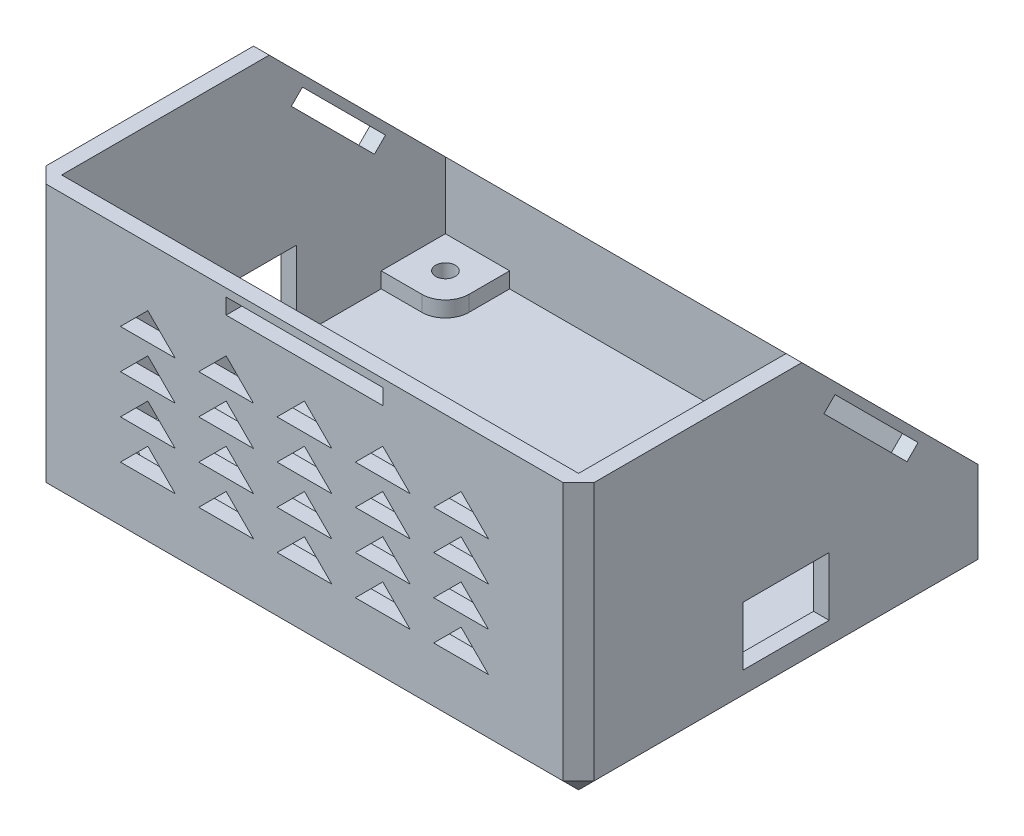
from build123d import *

# Parameters (mm, degrees)
SKETCH1_W               = 70
SKETCH1_H               = 53
SKETCH1_W_2             = 66
SKETCH1_H_2             = 49
BOSS_EXTRUDE1_DEPTH     = 2
BOSS_EXTRUDE2_START     = 2
SKETCH1_3_W             = 70
SKETCH1_3_H             = 53
SKETCH1_3_W_2           = 66
SKETCH1_3_H_2           = 49
BOSS_EXTRUDE2_DEPTH     = 33
CHAMFER1_SIZE           = 2
SKETCH2_R               = 1.25
BOSS_EXTRUDE3_DEPTH     = 2
MIRROR2_COPY_1_SKETCH_R = 1.25
MIRROR2_COPY_1_DEPTH    = 2
CUT_EXTRUDE1_DEPTH      = 1.6
MIRROR4_COPY_1_DEPTH    = 1.6
CUT_EXTRUDE2_DEPTH      = 55.92039694
CUT_EXTRUDE2_DEPTH_BACK = 55.92039694
SKETCH4_R               = 1.25
SKETCH7_W               = 11
SKETCH7_H               = 7.5
CUT_EXTRUDE5_DEPTH      = 83.627174707
CUT_EXTRUDE3_DEPTH      = 72.070387645
CUT_EXTRUDE3_DEPTH_BACK = 72.070387645
SKETCH5_W               = 20
SKETCH5_H               = 2
CUT_EXTRUDE8_DEPTH      = 83.627174707
CUT_EXTRUDE4_DEPTH      = 81.939792439
CUT_EXTRUDE4_DEPTH_BACK = 81.939792439
CUT_EXTRUDE9_REACH      = 74.519
LPATTERN2_COUNT         = 3
LPATTERN2_PITCH         = 10
LPATTERN2_COL_COUNT     = 3
LPATTERN2_COL_PITCH     = 10
LPATTERN3_COUNT         = 4
LPATTERN3_PITCH         = 5
LPATTERN3_COPY_1_REACH  = 74.519
LPATTERN3_COPY_2_REACH  = 74.519
LPATTERN3_COPY_3_REACH  = 74.519
LPATTERN3_COPY_4_REACH  = 74.519
LPATTERN3_COPY_5_REACH  = 74.519
LPATTERN3_COPY_6_REACH  = 74.519
LPATTERN3_COPY_7_REACH  = 74.519
LPATTERN3_COPY_8_REACH  = 74.519
LPATTERN3_COPY_9_REACH  = 74.519
LPATTERN3_COPY_10_REACH = 74.519
LPATTERN3_COPY_11_REACH = 74.519
LPATTERN3_COPY_12_REACH = 74.519


with BuildPart() as part:
    # Sketch1 → Boss-Extrude1 (new body)
    # profile 1 of 2: a face of its own
    with BuildSketch(Plane(origin=(0, 0, 0), x_dir=(1, 0, 0), z_dir=(0, 1, 0))):
        Rectangle(SKETCH1_W, SKETCH1_H)
        Rectangle(SKETCH1_W_2, SKETCH1_H_2, mode=Mode.SUBTRACT)
    # profile 2 of 2: a face of its own
    with BuildSketch(Plane(origin=(0, 0, 0), x_dir=(1, 0, 0), z_dir=(0, 1, 0))):
        Rectangle(SKETCH1_W_2, SKETCH1_H_2)
    extrude(amount=BOSS_EXTRUDE1_DEPTH)

    # Sketch1<3> → Boss-Extrude2 (add)
    with BuildSketch(Plane(origin=(0, 0, 0), x_dir=(1, 0, 0), z_dir=(0, 1, 0)).offset(BOSS_EXTRUDE2_START)):
        Rectangle(SKETCH1_3_W, SKETCH1_3_H)
        Rectangle(SKETCH1_3_W_2, SKETCH1_3_H_2, mode=Mode.SUBTRACT)
    extrude(amount=BOSS_EXTRUDE2_DEPTH)

    # Chamfer1
    chamfer1_edges = [part.edges().sort_by_distance(p)[0] for p in [
        (0, 0, -26.5),
        (35, 0, 0),
        (0, 0, 26.5),
        (-35, 0, 0),
        (-35, 17.5, -26.5),
        (35, 17.5, -26.5),
        (35, 17.5, 26.5),
        (-35, 17.5, 26.5),
    ]]
    chamfer(chamfer1_edges, length=CHAMFER1_SIZE)

    # Sketch2 → Boss-Extrude3 (add)
    with BuildSketch(Plane(origin=(0, 2, 0), x_dir=(1, 0, 0), z_dir=(0, 1, 0))):
        with BuildLine():
            Line((-33, 16.3), (-27.8, 16.3))
            ThreePointArc((-27.8, 16.3), (-25.678679656, 17.178679656), (-24.8, 19.3))
            Line((-24.8, 19.3), (-24.8, 24.5))
            Line((-24.8, 24.5), (-33, 24.5))
            Line((-33, 24.5), (-33, 16.3))
        make_face()
        with Locations(Location((-28.9, 20.4, 0), (0, 0, 270))):
            Circle(SKETCH2_R, mode=Mode.SUBTRACT)
    boss_extrude3 = extrude(amount=BOSS_EXTRUDE3_DEPTH)

    # Mirror1: Boss-Extrude3 across plane
    add(boss_extrude3.mirror(Plane.XY))

    # Mirror2: Boss-Extrude3 across plane
    add(boss_extrude3.mirror(Plane(origin=(0, 0, 0), x_dir=(0, 0, 1), z_dir=(1, 0, 0))))

    # Mirror2 copy 1 sketch → Mirror2 copy 1 (add)
    with BuildSketch(Plane(origin=(0, 2, 0), x_dir=(-1, 0, 0), z_dir=(0, 1, 0))):
        with BuildLine():
            Line((-33, 16.3), (-27.8, 16.3))
            ThreePointArc((-27.8, 16.3), (-25.678679656, 17.178679656), (-24.8, 19.3))
            Line((-24.8, 19.3), (-24.8, 24.5))
            Line((-24.8, 24.5), (-33, 24.5))
            Line((-33, 24.5), (-33, 16.3))
        make_face()
        with Locations(Location((-28.9, 20.4, 0), (0, 0, 270))):
            Circle(MIRROR2_COPY_1_SKETCH_R, mode=Mode.SUBTRACT)
    extrude(amount=MIRROR2_COPY_1_DEPTH)

    # Sketch3 → Cut-Extrude1 (cut)
    with BuildSketch(Plane.XZ):
        Polygon((-30.112435565, 22.5), (-27.687564435, 22.5), (-26.475128869, 20.4), (-27.687564435, 18.3), (-30.112435565, 18.3), (-31.324871131, 20.4), align=None)
    cut_extrude1 = extrude(amount=-CUT_EXTRUDE1_DEPTH, mode=Mode.SUBTRACT)

    # Mirror3: Cut-Extrude1 across plane
    add(cut_extrude1.mirror(Plane.XY), mode=Mode.SUBTRACT)

    # Mirror4: Cut-Extrude1 across plane
    add(cut_extrude1.mirror(Plane(origin=(0, 0, 0), x_dir=(0, 0, 1), z_dir=(1, 0, 0))), mode=Mode.SUBTRACT)

    # Mirror4 copy 1 sketch → Mirror4 copy 1 (cut)
    with BuildSketch(Plane(origin=(0, 0, 0), x_dir=(-1, 0, 0), z_dir=(0, -1, 0))):
        Polygon((-30.112435565, 22.5), (-27.687564435, 22.5), (-26.475128869, 20.4), (-27.687564435, 18.3), (-30.112435565, 18.3), (-31.324871131, 20.4), align=None)
    extrude(amount=-MIRROR4_COPY_1_DEPTH, mode=Mode.SUBTRACT)

    # Sketch4 → Cut-Extrude2 (cut, two sides: drawn at the far end of the back side and taken through both)
    with BuildSketch(Plane(origin=(0, 2, 0), x_dir=(1, 0, 0), z_dir=(0, 1, 0)).offset(-CUT_EXTRUDE2_DEPTH_BACK)):
        with Locations(Location((28.9, -20.4, 0), (0, 0, 90))):
            Circle(SKETCH4_R)
        with Locations(Location((28.9, 20.4, 0), (0, 0, 270))):
            Circle(SKETCH4_R)
        with Locations(Location((-28.9, 20.4, 0), (0, 0, 270))):
            Circle(SKETCH4_R)
        with Locations(Location((-28.9, -20.4, 0), (0, 0, 90))):
            Circle(SKETCH4_R)
    extrude(amount=CUT_EXTRUDE2_DEPTH + CUT_EXTRUDE2_DEPTH_BACK, mode=Mode.SUBTRACT)

    # Sketch7 → Cut-Extrude5 (cut, through all)
    with BuildSketch(Plane(origin=(35, 0, 0), x_dir=(0, 0, -1), z_dir=(1, 0, 0))):
        with Locations((0, 8.5)):
            Rectangle(SKETCH7_W, SKETCH7_H)
    extrude(amount=-CUT_EXTRUDE5_DEPTH, mode=Mode.SUBTRACT)

    # Sketch5 → Cut-Extrude3 (cut, two sides: drawn at the far end of the back side and taken through both)
    with BuildSketch(Plane(origin=(0, 0, 24.5), x_dir=(-1, 0, 0), z_dir=(0, 0, -1)).offset(-CUT_EXTRUDE3_DEPTH_BACK)):
        with Locations((0, 33)):
            Rectangle(SKETCH5_W, SKETCH5_H)
    extrude(amount=CUT_EXTRUDE3_DEPTH + CUT_EXTRUDE3_DEPTH_BACK, mode=Mode.SUBTRACT)

    # Sketch9 → Cut-Extrude8 (cut, through all)
    with BuildSketch(Plane(origin=(35, 0, 0), x_dir=(0, 0, -1), z_dir=(1, 0, 0))):
        Polygon((2, 35), (26.5, 10.5), (26.5, 35), align=None)
    extrude(amount=-CUT_EXTRUDE8_DEPTH, mode=Mode.SUBTRACT)

    # Sketch6 → Cut-Extrude4 (cut, two sides: drawn at the far end of the back side and taken through both)
    with BuildSketch(Plane(origin=(-33, 0, 0), x_dir=(0, 0, -1), z_dir=(1, 0, 0)).offset(-CUT_EXTRUDE4_DEPTH_BACK)):
        Polygon((6.242640687, 29.343145751), (16.849242405, 18.736544033), (15.435028843, 17.32233047), (4.828427125, 27.928932188), align=None)
    extrude(amount=CUT_EXTRUDE4_DEPTH + CUT_EXTRUDE4_DEPTH_BACK, mode=Mode.SUBTRACT)

    # Sketch11 → Cut-Extrude9 (cut, up to next)
    with BuildSketch(Plane.XY.offset(26.5), mode=Mode.PRIVATE) as cut_extrude9_sk1:
        Polygon((0, 27.5), (-3.5, 24), (3.5, 24), align=None)
    cut_extrude9_tool1 = extrude(cut_extrude9_sk1.sketch, amount=-CUT_EXTRUDE9_REACH, mode=Mode.PRIVATE) & part.part
    cut_extrude9 = cut_extrude9_tool1.solids().sort_by_distance((0, 25.166667, 26.5))[0]
    add(cut_extrude9, mode=Mode.SUBTRACT)

    # LPattern2: Cut-Extrude9 ×3
    with Locations(*[(i * LPATTERN2_PITCH, 0, 0) for i in range(1, LPATTERN2_COUNT)]):
        add(cut_extrude9, mode=Mode.SUBTRACT)

    # LPattern2 col: Cut-Extrude9 ×3
    with Locations(*[(-i * LPATTERN2_COL_PITCH, 0, 0) for i in range(1, LPATTERN2_COL_COUNT)]):
        add(cut_extrude9, mode=Mode.SUBTRACT)

    # LPattern3: Cut-Extrude9 ×4
    with Locations(*[(0, -i * LPATTERN3_PITCH, 0) for i in range(1, LPATTERN3_COUNT)]):
        add(cut_extrude9, mode=Mode.SUBTRACT)

    # LPattern3 copy 1 sketch → LPattern3 copy 1 (cut, up to next)
    with BuildSketch(Plane(origin=(10, -5, 26.5), x_dir=(1, 0, 0), z_dir=(0, 0, 1)), mode=Mode.PRIVATE) as lpattern3_copy_1_sk1:
        Polygon((0, 27.5), (-3.5, 24), (3.5, 24), align=None)
    lpattern3_copy_1_tool1 = extrude(lpattern3_copy_1_sk1.sketch, amount=-LPATTERN3_COPY_1_REACH, mode=Mode.PRIVATE) & part.part
    add(lpattern3_copy_1_tool1.solids().sort_by_distance((10, 20.166667, 26.5))[0], mode=Mode.SUBTRACT)

    # LPattern3 copy 2 sketch → LPattern3 copy 2 (cut, up to next)
    with BuildSketch(Plane(origin=(10, -10, 26.5), x_dir=(1, 0, 0), z_dir=(0, 0, 1)), mode=Mode.PRIVATE) as lpattern3_copy_2_sk1:
        Polygon((0, 27.5), (-3.5, 24), (3.5, 24), align=None)
    lpattern3_copy_2_tool1 = extrude(lpattern3_copy_2_sk1.sketch, amount=-LPATTERN3_COPY_2_REACH, mode=Mode.PRIVATE) & part.part
    add(lpattern3_copy_2_tool1.solids().sort_by_distance((10, 15.166667, 26.5))[0], mode=Mode.SUBTRACT)

    # LPattern3 copy 3 sketch → LPattern3 copy 3 (cut, up to next)
    with BuildSketch(Plane(origin=(10, -15, 26.5), x_dir=(1, 0, 0), z_dir=(0, 0, 1)), mode=Mode.PRIVATE) as lpattern3_copy_3_sk1:
        Polygon((0, 27.5), (-3.5, 24), (3.5, 24), align=None)
    lpattern3_copy_3_tool1 = extrude(lpattern3_copy_3_sk1.sketch, amount=-LPATTERN3_COPY_3_REACH, mode=Mode.PRIVATE) & part.part
    add(lpattern3_copy_3_tool1.solids().sort_by_distance((10, 10.166667, 26.5))[0], mode=Mode.SUBTRACT)

    # LPattern3 copy 4 sketch → LPattern3 copy 4 (cut, up to next)
    with BuildSketch(Plane(origin=(20, -5, 26.5), x_dir=(1, 0, 0), z_dir=(0, 0, 1)), mode=Mode.PRIVATE) as lpattern3_copy_4_sk1:
        Polygon((0, 27.5), (-3.5, 24), (3.5, 24), align=None)
    lpattern3_copy_4_tool1 = extrude(lpattern3_copy_4_sk1.sketch, amount=-LPATTERN3_COPY_4_REACH, mode=Mode.PRIVATE) & part.part
    add(lpattern3_copy_4_tool1.solids().sort_by_distance((20, 20.166667, 26.5))[0], mode=Mode.SUBTRACT)

    # LPattern3 copy 5 sketch → LPattern3 copy 5 (cut, up to next)
    with BuildSketch(Plane(origin=(20, -10, 26.5), x_dir=(1, 0, 0), z_dir=(0, 0, 1)), mode=Mode.PRIVATE) as lpattern3_copy_5_sk1:
        Polygon((0, 27.5), (-3.5, 24), (3.5, 24), align=None)
    lpattern3_copy_5_tool1 = extrude(lpattern3_copy_5_sk1.sketch, amount=-LPATTERN3_COPY_5_REACH, mode=Mode.PRIVATE) & part.part
    add(lpattern3_copy_5_tool1.solids().sort_by_distance((20, 15.166667, 26.5))[0], mode=Mode.SUBTRACT)

    # LPattern3 copy 6 sketch → LPattern3 copy 6 (cut, up to next)
    with BuildSketch(Plane(origin=(20, -15, 26.5), x_dir=(1, 0, 0), z_dir=(0, 0, 1)), mode=Mode.PRIVATE) as lpattern3_copy_6_sk1:
        Polygon((0, 27.5), (-3.5, 24), (3.5, 24), align=None)
    lpattern3_copy_6_tool1 = extrude(lpattern3_copy_6_sk1.sketch, amount=-LPATTERN3_COPY_6_REACH, mode=Mode.PRIVATE) & part.part
    add(lpattern3_copy_6_tool1.solids().sort_by_distance((20, 10.166667, 26.5))[0], mode=Mode.SUBTRACT)

    # LPattern3 copy 7 sketch → LPattern3 copy 7 (cut, up to next)
    with BuildSketch(Plane(origin=(-10, -5, 26.5), x_dir=(1, 0, 0), z_dir=(0, 0, 1)), mode=Mode.PRIVATE) as lpattern3_copy_7_sk1:
        Polygon((0, 27.5), (-3.5, 24), (3.5, 24), align=None)
    lpattern3_copy_7_tool1 = extrude(lpattern3_copy_7_sk1.sketch, amount=-LPATTERN3_COPY_7_REACH, mode=Mode.PRIVATE) & part.part
    add(lpattern3_copy_7_tool1.solids().sort_by_distance((-10, 20.166667, 26.5))[0], mode=Mode.SUBTRACT)

    # LPattern3 copy 8 sketch → LPattern3 copy 8 (cut, up to next)
    with BuildSketch(Plane(origin=(-10, -10, 26.5), x_dir=(1, 0, 0), z_dir=(0, 0, 1)), mode=Mode.PRIVATE) as lpattern3_copy_8_sk1:
        Polygon((0, 27.5), (-3.5, 24), (3.5, 24), align=None)
    lpattern3_copy_8_tool1 = extrude(lpattern3_copy_8_sk1.sketch, amount=-LPATTERN3_COPY_8_REACH, mode=Mode.PRIVATE) & part.part
    add(lpattern3_copy_8_tool1.solids().sort_by_distance((-10, 15.166667, 26.5))[0], mode=Mode.SUBTRACT)

    # LPattern3 copy 9 sketch → LPattern3 copy 9 (cut, up to next)
    with BuildSketch(Plane(origin=(-10, -15, 26.5), x_dir=(1, 0, 0), z_dir=(0, 0, 1)), mode=Mode.PRIVATE) as lpattern3_copy_9_sk1:
        Polygon((0, 27.5), (-3.5, 24), (3.5, 24), align=None)
    lpattern3_copy_9_tool1 = extrude(lpattern3_copy_9_sk1.sketch, amount=-LPATTERN3_COPY_9_REACH, mode=Mode.PRIVATE) & part.part
    add(lpattern3_copy_9_tool1.solids().sort_by_distance((-10, 10.166667, 26.5))[0], mode=Mode.SUBTRACT)

    # LPattern3 copy 10 sketch → LPattern3 copy 10 (cut, up to next)
    with BuildSketch(Plane(origin=(-20, -5, 26.5), x_dir=(1, 0, 0), z_dir=(0, 0, 1)), mode=Mode.PRIVATE) as lpattern3_copy_10_sk1:
        Polygon((0, 27.5), (-3.5, 24), (3.5, 24), align=None)
    lpattern3_copy_10_tool1 = extrude(lpattern3_copy_10_sk1.sketch, amount=-LPATTERN3_COPY_10_REACH, mode=Mode.PRIVATE) & part.part
    add(lpattern3_copy_10_tool1.solids().sort_by_distance((-20, 20.166667, 26.5))[0], mode=Mode.SUBTRACT)

    # LPattern3 copy 11 sketch → LPattern3 copy 11 (cut, up to next)
    with BuildSketch(Plane(origin=(-20, -10, 26.5), x_dir=(1, 0, 0), z_dir=(0, 0, 1)), mode=Mode.PRIVATE) as lpattern3_copy_11_sk1:
        Polygon((0, 27.5), (-3.5, 24), (3.5, 24), align=None)
    lpattern3_copy_11_tool1 = extrude(lpattern3_copy_11_sk1.sketch, amount=-LPATTERN3_COPY_11_REACH, mode=Mode.PRIVATE) & part.part
    add(lpattern3_copy_11_tool1.solids().sort_by_distance((-20, 15.166667, 26.5))[0], mode=Mode.SUBTRACT)

    # LPattern3 copy 12 sketch → LPattern3 copy 12 (cut, up to next)
    with BuildSketch(Plane(origin=(-20, -15, 26.5), x_dir=(1, 0, 0), z_dir=(0, 0, 1)), mode=Mode.PRIVATE) as lpattern3_copy_12_sk1:
        Polygon((0, 27.5), (-3.5, 24), (3.5, 24), align=None)
    lpattern3_copy_12_tool1 = extrude(lpattern3_copy_12_sk1.sketch, amount=-LPATTERN3_COPY_12_REACH, mode=Mode.PRIVATE) & part.part
    add(lpattern3_copy_12_tool1.solids().sort_by_distance((-20, 10.166667, 26.5))[0], mode=Mode.SUBTRACT)


solid = part.part
